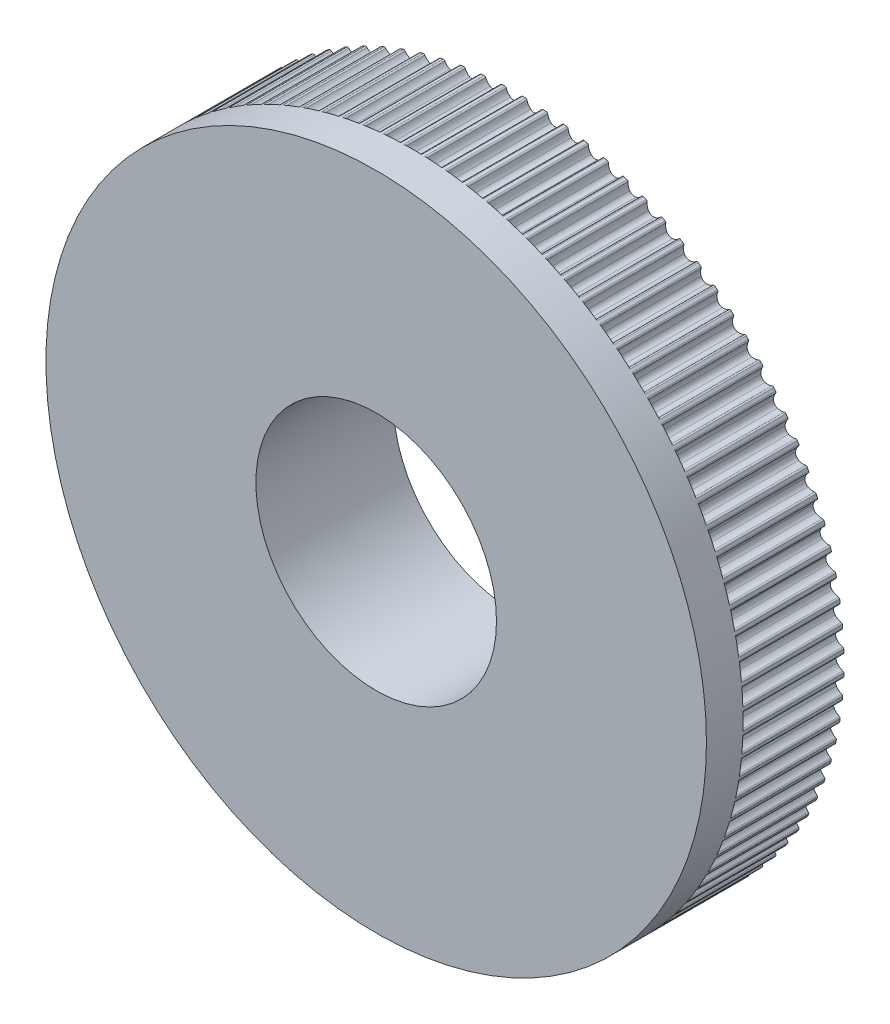
from build123d import *

# Parameters (mm, degrees)
SKETCH2_W           = 9.65
SKETCH2_H           = 20.0722
CUT_EXTRUDE1_START  = 0.125
CUT_EXTRUDE1_DEPTH  = 46.77949869
CIRPATTERN1_COUNT   = 100
BOSS_EXTRUDE1_START = 3.5
SKETCH7_R           = 31.5722
SKETCH7_R_2         = 11.5
BOSS_EXTRUDE1_DEPTH = 3.5


with BuildPart() as part:
    # Sketch2 → Revolve1 (revolve)
    with BuildSketch(Plane(origin=(0, 0, 0), x_dir=(0, 0, -1), z_dir=(1, 0, 0)), mode=Mode.PRIVATE) as revolve1_sk:
        with Locations((4.7, 21.5361)):
            Rectangle(SKETCH2_W, SKETCH2_H)
    revolve(revolve1_sk.sketch.rotate(Axis((0, 0, 9.525), (0, 0, -1)), 90), axis=Axis((0, 0, 9.525), (0, 0, -1)))

    # Sketch3 → Cut-Extrude1 (cut, through all)
    with BuildSketch(Plane.XY.offset(CUT_EXTRUDE1_START)):
        with BuildLine():
            Line((1.998996542, 31.508853132), (2.036722353, 32.1035))
            Line((2.036722353, 32.1035), (-2.036722353, 32.1035))
            Line((-2.036722353, 32.1035), (-1.998996542, 31.508853132))
            ThreePointArc((-1.998996542, 31.508853132), (-1.425301962, 31.540011528), (-0.851135386, 31.560725299))
            ThreePointArc((-0.851135386, 31.560725299), (-0.759257476, 31.532374065), (-0.703470982, 31.454059253))
            ThreePointArc((-0.703470982, 31.454059253), (-0.555197232, 31.155051737), (-0.316786517, 30.921490331))
            ThreePointArc((-0.316786517, 30.921490331), (0, 30.8222), (0.316786517, 30.921490331))
            ThreePointArc((0.316786517, 30.921490331), (0.555197232, 31.155051737), (0.703470982, 31.454059253))
            ThreePointArc((0.703470982, 31.454059253), (0.759257476, 31.532374065), (0.851135386, 31.560725299))
            ThreePointArc((0.851135386, 31.560725299), (1.425301962, 31.540011528), (1.998996542, 31.508853132))
        make_face()
    cut_extrude1 = extrude(amount=-CUT_EXTRUDE1_DEPTH, mode=Mode.SUBTRACT)

    # CirPattern1: Cut-Extrude1 ×100 about axis
    cirpattern1_axis = Axis((0, 0, 0), (0, 0, 1))
    for i in range(1, CIRPATTERN1_COUNT):
        add(cut_extrude1.rotate(cirpattern1_axis, i * 360 / CIRPATTERN1_COUNT), mode=Mode.SUBTRACT)

    # Sketch7 → Boss-Extrude1 (add)
    with BuildSketch(Plane.XY.offset(0.125).offset(BOSS_EXTRUDE1_START)):
        Circle(SKETCH7_R)
        Circle(SKETCH7_R_2, mode=Mode.SUBTRACT)
    extrude(amount=-BOSS_EXTRUDE1_DEPTH)


solid = part.part
